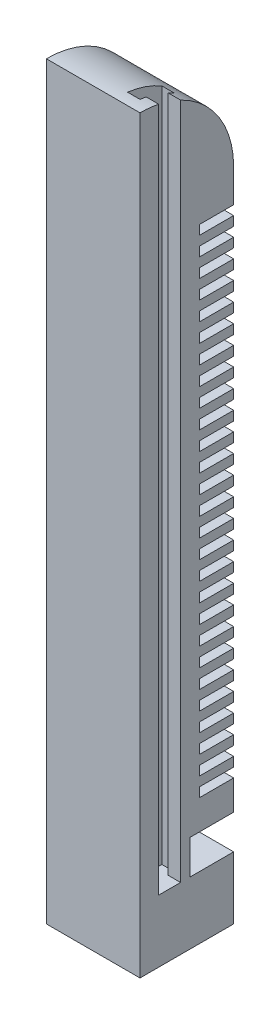
from build123d import *

# Parameters (mm, degrees)
SKETCH1_W           = 15
SKETCH1_H           = 15
BOSS_EXTRUDE1_DEPTH = 120
CUT_EXTRUDE1_DEPTH  = 110
CUT_EXTRUDE2_START  = -20.25
CUT_EXTRUDE2_DEPTH  = 1.5
LPATTERN1_COUNT     = 27
LPATTERN1_PITCH     = 3
CUT_EXTRUDE3_START  = -10
SKETCH6_W           = 7
SKETCH6_H           = 7
CUT_EXTRUDE3_DEPTH  = 5.5
CUT_EXTRUDE4_DEPTH  = 122.86057607


with BuildPart() as part:
    # Sketch1 → Boss-Extrude1 (new body)
    with BuildSketch(Plane(origin=(0, 0, 0), x_dir=(1, 0, 0), z_dir=(0, 1, 0))):
        with Locations((7.5, 7.5)):
            Rectangle(SKETCH1_W, SKETCH1_H)
    extrude(amount=BOSS_EXTRUDE1_DEPTH)

    # Sketch3 → Cut-Extrude1 (cut)
    with BuildSketch(Plane(origin=(0, 120, 0), x_dir=(1, 0, 0), z_dir=(0, 1, 0))):
        Polygon((15, 3), (13, 3), (13, 2), (11, 2), (11, 7.5), (13, 7.5), (13, 6.5), (15, 6.5), align=None)
        Polygon((3, 13), (2, 13), (2, 11), (7.5, 11), (7.5, 13), (6.5, 13), (6.5, 15), (3, 15), align=None)
    extrude(amount=-CUT_EXTRUDE1_DEPTH, mode=Mode.SUBTRACT)

    # Sketch5 → Cut-Extrude2 (cut)
    with BuildSketch(Plane(origin=(0, 120, 0), x_dir=(1, 0, 0), z_dir=(0, 1, 0)).offset(CUT_EXTRUDE2_START)):
        Polygon((15, 15), (15, 9.5), (9.5, 15), align=None)
    cut_extrude2 = extrude(amount=-CUT_EXTRUDE2_DEPTH, mode=Mode.SUBTRACT)

    # LPattern1: Cut-Extrude2 ×27
    with Locations(*[(0, -i * LPATTERN1_PITCH, 0) for i in range(1, LPATTERN1_COUNT)]):
        add(cut_extrude2, mode=Mode.SUBTRACT)

    # Sketch6 → Cut-Extrude3 (cut)
    with BuildSketch(Plane.XZ.offset(CUT_EXTRUDE3_START)):
        with Locations((11.5, -11.5)):
            Rectangle(SKETCH6_W, SKETCH6_H)
    extrude(amount=-CUT_EXTRUDE3_DEPTH, mode=Mode.SUBTRACT)

    # Sketch7 → Cut-Extrude4 (cut, through all)
    with BuildSketch(Plane.ZY):
        with BuildLine():
            Line((-15, 105), (-15, 120))
            Line((-15, 120), (0, 120))
            ThreePointArc((0, 120), (-10.606601718, 115.606601718), (-15, 105))
        make_face()
    extrude(amount=-CUT_EXTRUDE4_DEPTH, mode=Mode.SUBTRACT)


solid = part.part
